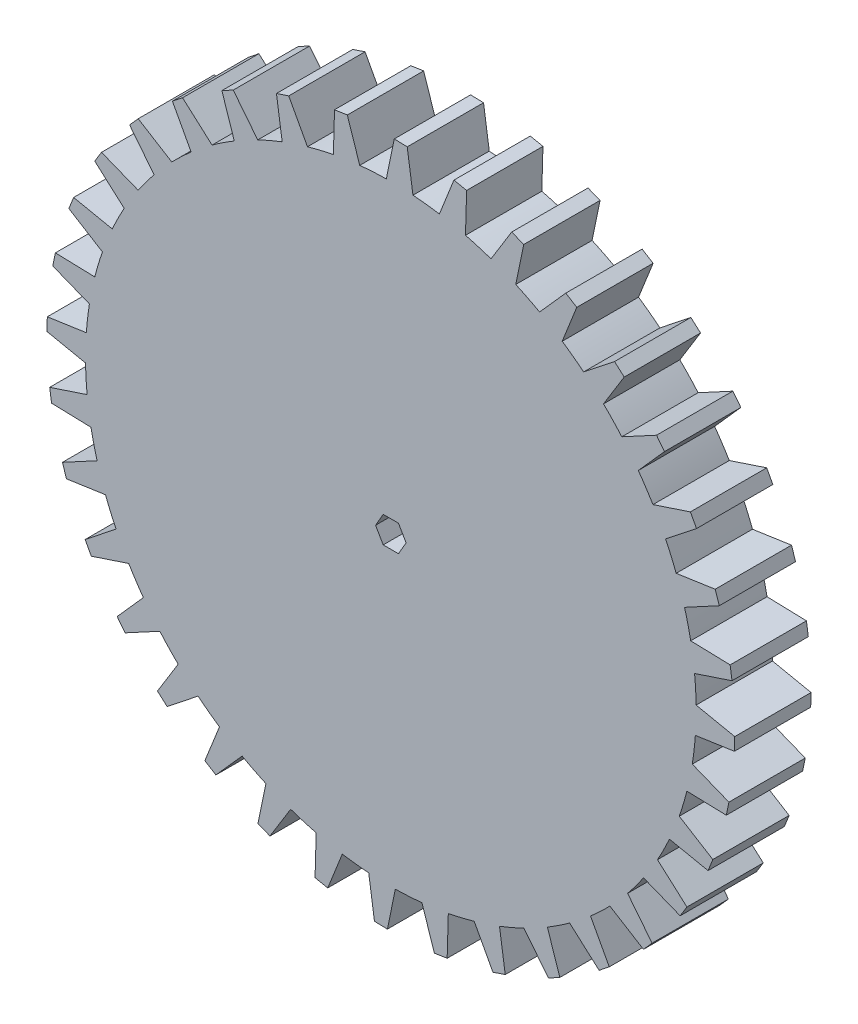
from build123d import *

# Parameters (mm, degrees)
EXTRUDE_1_DEPTH = 12.7


with BuildPart() as part:
    # 草图1 → 凸台-拉伸1 (new body)
    with BuildSketch(Plane.XY):
        with BuildLine():
            Line((-9.371553452, 56.452665719), (-9.56076374, 49.892201762))
            ThreePointArc((-9.56076374, 49.892201762), (-11.727931287, 49.427680784), (-13.87277405, 48.869071407))
            Line((-13.87277405, 48.869071407), (-16.989145112, 54.645204998))
            Line((-16.989145112, 54.645204998), (-19.032081024, 53.9676697))
            Line((-19.032081024, 53.9676697), (-18.079204172, 47.47401791))
            ThreePointArc((-18.079204172, 47.47401791), (-20.132784353, 46.640229354), (-22.148040634, 45.717658471))
            Line((-22.148040634, 45.717658471), (-26.22008209, 50.864887458))
            Line((-26.22008209, 50.864887458), (-28.114328445, 49.842893345))
            Line((-28.114328445, 49.842893345), (-26.048317134, 43.613360046))
            ThreePointArc((-26.048317134, 43.613360046), (-27.925912954, 42.435638156), (-29.750350211, 41.177137617))
            Line((-29.750350211, 41.177137617), (-34.654335141, 45.539066052))
            Line((-34.654335141, 45.539066052), (-36.342336222, 44.203665898))
            Line((-36.342336222, 44.203665898), (-33.22596516, 38.427532307))
            ThreePointArc((-33.22596516, 38.427532307), (-34.870526821, 36.941661566), (-36.448710452, 35.385470273))
            Line((-36.448710452, 35.385470273), (-42.035633755, 38.829563167))
            Line((-42.035633755, 38.829563167), (-43.466100504, 37.221332431))
            Line((-43.466100504, 37.221332431), (-39.394059048, 32.074103444))
            ThreePointArc((-39.394059048, 32.074103444), (-40.755617375, 30.325231283), (-42.039595069, 28.51863332))
            Line((-42.039595069, 28.51863332), (-48.139700908, 30.940243655))
            Line((-48.139700908, 30.940243655), (-49.269169316, 29.108047612))
            Line((-49.269169316, 29.108047612), (-44.365184387, 24.746119178))
            ThreePointArc((-44.365184387, 24.746119178), (-45.40236912, 22.787384192), (-46.353127863, 20.785272126))
            Line((-46.353127863, 20.785272126), (-52.781067609, 22.110820495))
            Line((-52.781067609, 22.110820495), (-53.57521935, 20.110329497))
            Line((-53.57521935, 20.110329497), (-47.988296047, 16.666236602))
            ThreePointArc((-47.988296047, 16.666236602), (-48.669592853, 14.557153964), (-49.258244323, 12.420360955))
            Line((-49.258244323, 12.420360955), (-55.818708279, 12.609571243))
            Line((-55.818708279, 12.609571243), (-56.253413455, 10.501569196))
            Line((-56.253413455, 10.501569196), (-50.153307616, 8.079958862))
            ThreePointArc((-50.153307616, 8.079958862), (-50.458015635, 5.884611979), (-50.666673954, 3.678063402))
            Line((-50.666673954, 3.678063402), (-57.160325744, 2.72518655))
            Line((-57.160325744, 2.72518655), (-57.222376057, 0.573724029))
            Line((-57.222376057, 0.573724029), (-50.794436311, -0.75182434))
            ThreePointArc((-50.794436311, -0.75182434), (-50.713297146, -2.966730964), (-50.535622337, -5.175990246))
            Line((-50.535622337, -5.175990246), (-56.765155636, -7.242001557))
            Line((-56.765155636, -7.242001557), (-56.452665719, -9.371553452))
            Line((-56.452665719, -9.371553452), (-49.892201762, -9.56076374))
            ThreePointArc((-49.892201762, -9.56076374), (-49.427680784, -11.727931287), (-48.869071407, -13.87277405))
            Line((-48.869071407, -13.87277405), (-54.645204998, -16.989145112))
            Line((-54.645204998, -16.989145112), (-53.9676697, -19.032081024))
            Line((-53.9676697, -19.032081024), (-47.47401791, -18.079204172))
            ThreePointArc((-47.47401791, -18.079204172), (-46.640229354, -20.132784353), (-45.717658471, -22.148040634))
            Line((-45.717658471, -22.148040634), (-50.864887458, -26.22008209))
            Line((-50.864887458, -26.22008209), (-49.842893345, -28.114328445))
            Line((-49.842893345, -28.114328445), (-43.613360046, -26.048317134))
            ThreePointArc((-43.613360046, -26.048317134), (-42.435638156, -27.925912954), (-41.177137617, -29.750350211))
            Line((-41.177137617, -29.750350211), (-45.539066052, -34.654335141))
            Line((-45.539066052, -34.654335141), (-44.203665898, -36.342336222))
            Line((-44.203665898, -36.342336222), (-38.427532307, -33.22596516))
            ThreePointArc((-38.427532307, -33.22596516), (-36.941661566, -34.870526821), (-35.385470273, -36.448710452))
            Line((-35.385470273, -36.448710452), (-38.829563167, -42.035633755))
            Line((-38.829563167, -42.035633755), (-37.221332431, -43.466100504))
            Line((-37.221332431, -43.466100504), (-32.074103444, -39.394059048))
            ThreePointArc((-32.074103444, -39.394059048), (-30.325231283, -40.755617375), (-28.51863332, -42.039595069))
            Line((-28.51863332, -42.039595069), (-30.940243655, -48.139700908))
            Line((-30.940243655, -48.139700908), (-29.108047612, -49.269169316))
            Line((-29.108047612, -49.269169316), (-24.746119178, -44.365184387))
            ThreePointArc((-24.746119178, -44.365184387), (-22.787384192, -45.40236912), (-20.785272126, -46.353127863))
            Line((-20.785272126, -46.353127863), (-22.110820495, -52.781067609))
            Line((-22.110820495, -52.781067609), (-20.110329497, -53.57521935))
            Line((-20.110329497, -53.57521935), (-16.666236602, -47.988296047))
            ThreePointArc((-16.666236602, -47.988296047), (-14.557153964, -48.669592853), (-12.420360955, -49.258244323))
            Line((-12.420360955, -49.258244323), (-12.609571243, -55.818708279))
            Line((-12.609571243, -55.818708279), (-10.501569196, -56.253413455))
            Line((-10.501569196, -56.253413455), (-8.079958862, -50.153307616))
            ThreePointArc((-8.079958862, -50.153307616), (-5.884611979, -50.458015635), (-3.678063402, -50.666673954))
            Line((-3.678063402, -50.666673954), (-2.72518655, -57.160325744))
            Line((-2.72518655, -57.160325744), (-0.573724029, -57.222376057))
            Line((-0.573724029, -57.222376057), (0.75182434, -50.794436311))
            ThreePointArc((0.75182434, -50.794436311), (2.966730964, -50.713297146), (5.175990246, -50.535622337))
            Line((5.175990246, -50.535622337), (7.242001557, -56.765155636))
            Line((7.242001557, -56.765155636), (9.371553452, -56.452665719))
            Line((9.371553452, -56.452665719), (9.56076374, -49.892201762))
            ThreePointArc((9.56076374, -49.892201762), (11.727931287, -49.427680784), (13.87277405, -48.869071407))
            Line((13.87277405, -48.869071407), (16.989145112, -54.645204998))
            Line((16.989145112, -54.645204998), (19.032081024, -53.9676697))
            Line((19.032081024, -53.9676697), (18.079204172, -47.47401791))
            ThreePointArc((18.079204172, -47.47401791), (20.132784353, -46.640229354), (22.148040634, -45.717658471))
            Line((22.148040634, -45.717658471), (26.22008209, -50.864887458))
            Line((26.22008209, -50.864887458), (28.114328445, -49.842893345))
            Line((28.114328445, -49.842893345), (26.048317134, -43.613360046))
            ThreePointArc((26.048317134, -43.613360046), (27.925912954, -42.435638156), (29.750350211, -41.177137617))
            Line((29.750350211, -41.177137617), (34.654335141, -45.539066052))
            Line((34.654335141, -45.539066052), (36.342336222, -44.203665898))
            Line((36.342336222, -44.203665898), (33.22596516, -38.427532307))
            ThreePointArc((33.22596516, -38.427532307), (34.870526821, -36.941661566), (36.448710452, -35.385470273))
            Line((36.448710452, -35.385470273), (42.035633755, -38.829563167))
            Line((42.035633755, -38.829563167), (43.466100504, -37.221332431))
            Line((43.466100504, -37.221332431), (39.394059048, -32.074103444))
            ThreePointArc((39.394059048, -32.074103444), (40.755617375, -30.325231283), (42.039595069, -28.51863332))
            Line((42.039595069, -28.51863332), (48.139700908, -30.940243655))
            Line((48.139700908, -30.940243655), (49.269169316, -29.108047612))
            Line((49.269169316, -29.108047612), (44.365184387, -24.746119178))
            ThreePointArc((44.365184387, -24.746119178), (45.40236912, -22.787384192), (46.353127863, -20.785272126))
            Line((46.353127863, -20.785272126), (52.781067609, -22.110820495))
            Line((52.781067609, -22.110820495), (53.57521935, -20.110329497))
            Line((53.57521935, -20.110329497), (47.988296047, -16.666236602))
            ThreePointArc((47.988296047, -16.666236602), (48.669592853, -14.557153964), (49.258244323, -12.420360955))
            Line((49.258244323, -12.420360955), (55.818708279, -12.609571243))
            Line((55.818708279, -12.609571243), (56.253413455, -10.501569196))
            Line((56.253413455, -10.501569196), (50.153307616, -8.079958862))
            ThreePointArc((50.153307616, -8.079958862), (50.458015635, -5.884611979), (50.666673954, -3.678063402))
            Line((50.666673954, -3.678063402), (57.160325744, -2.72518655))
            Line((57.160325744, -2.72518655), (57.222376057, -0.573724029))
            Line((57.222376057, -0.573724029), (50.794436311, 0.75182434))
            ThreePointArc((50.794436311, 0.75182434), (50.713297146, 2.966730964), (50.535622337, 5.175990246))
            Line((50.535622337, 5.175990246), (56.765155636, 7.242001557))
            Line((56.765155636, 7.242001557), (56.452665719, 9.371553452))
            Line((56.452665719, 9.371553452), (49.892201762, 9.56076374))
            ThreePointArc((49.892201762, 9.56076374), (49.427680784, 11.727931287), (48.869071407, 13.87277405))
            Line((48.869071407, 13.87277405), (54.645204998, 16.989145112))
            Line((54.645204998, 16.989145112), (53.9676697, 19.032081024))
            Line((53.9676697, 19.032081024), (47.47401791, 18.079204172))
            ThreePointArc((47.47401791, 18.079204172), (46.640229354, 20.132784353), (45.717658471, 22.148040634))
            Line((45.717658471, 22.148040634), (50.864887458, 26.22008209))
            Line((50.864887458, 26.22008209), (49.842893345, 28.114328445))
            Line((49.842893345, 28.114328445), (43.613360046, 26.048317134))
            ThreePointArc((43.613360046, 26.048317134), (42.435638156, 27.925912954), (41.177137617, 29.750350211))
            Line((41.177137617, 29.750350211), (45.539066052, 34.654335141))
            Line((45.539066052, 34.654335141), (44.203665898, 36.342336222))
            Line((44.203665898, 36.342336222), (38.427532307, 33.22596516))
            ThreePointArc((38.427532307, 33.22596516), (36.941661566, 34.870526821), (35.385470273, 36.448710452))
            Line((35.385470273, 36.448710452), (38.829563167, 42.035633755))
            Line((38.829563167, 42.035633755), (37.221332431, 43.466100504))
            Line((37.221332431, 43.466100504), (32.074103444, 39.394059048))
            ThreePointArc((32.074103444, 39.394059048), (30.325231283, 40.755617375), (28.51863332, 42.039595069))
            Line((28.51863332, 42.039595069), (30.940243655, 48.139700908))
            Line((30.940243655, 48.139700908), (29.108047612, 49.269169316))
            Line((29.108047612, 49.269169316), (24.746119178, 44.365184387))
            ThreePointArc((24.746119178, 44.365184387), (22.787384192, 45.40236912), (20.785272126, 46.353127863))
            Line((20.785272126, 46.353127863), (22.110820495, 52.781067609))
            Line((22.110820495, 52.781067609), (20.110329497, 53.57521935))
            Line((20.110329497, 53.57521935), (16.666236602, 47.988296047))
            ThreePointArc((16.666236602, 47.988296047), (14.557153964, 48.669592853), (12.420360955, 49.258244323))
            Line((12.420360955, 49.258244323), (12.609571243, 55.818708279))
            Line((12.609571243, 55.818708279), (10.501569196, 56.253413455))
            Line((10.501569196, 56.253413455), (8.079958862, 50.153307616))
            ThreePointArc((8.079958862, 50.153307616), (5.884611979, 50.458015635), (3.678063402, 50.666673954))
            Line((3.678063402, 50.666673954), (2.72518655, 57.160325744))
            Line((2.72518655, 57.160325744), (0.573724029, 57.222376057))
            Line((0.573724029, 57.222376057), (-0.75182434, 50.794436311))
            ThreePointArc((-0.75182434, 50.794436311), (-2.966730964, 50.713297146), (-5.175990246, 50.535622337))
            Line((-5.175990246, 50.535622337), (-7.242001557, 56.765155636))
            Line((-7.242001557, 56.765155636), (-9.371553452, 56.452665719))
        make_face()
        Polygon((2.54, 0), (1.27, -2.199704526), (-1.27, -2.199704526), (-2.54, 0), (-1.27, 2.199704526), (1.27, 2.199704526), align=None, mode=Mode.SUBTRACT)
    extrude(amount=EXTRUDE_1_DEPTH)


solid = part.part
